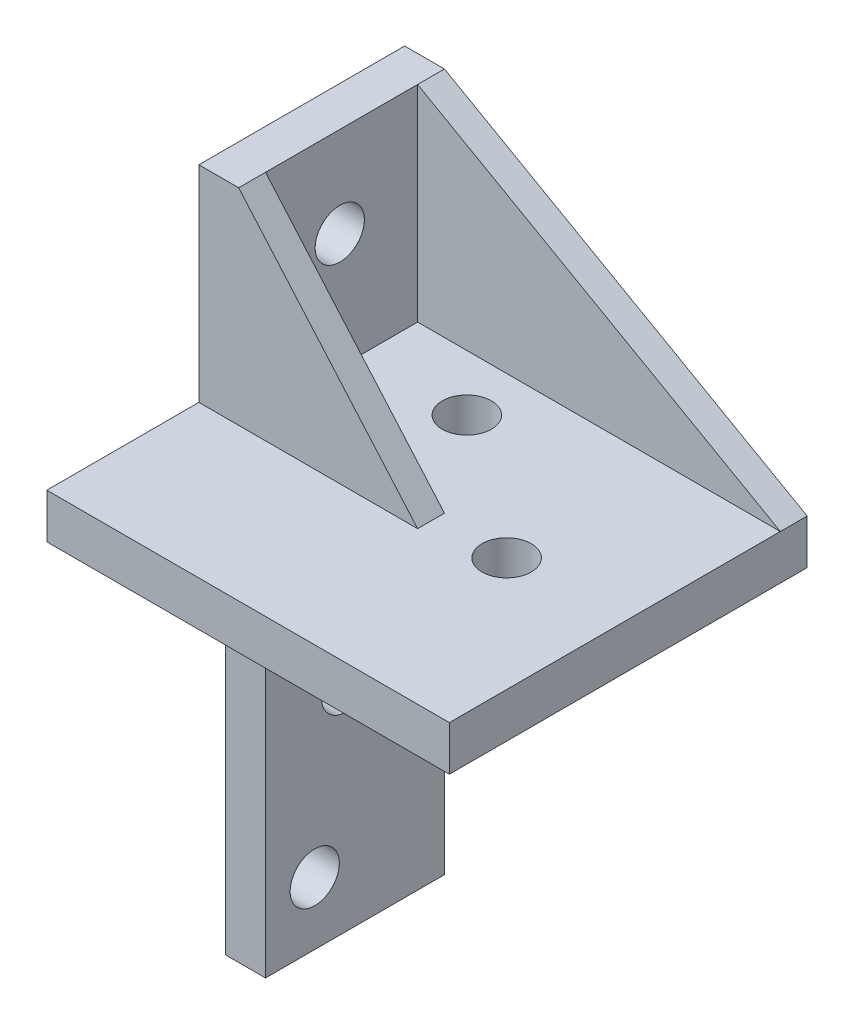
from build123d import *

# Parameters (mm, degrees)
SKETCH1_W           = 20
SKETCH1_H           = 50
BOSS_EXTRUDE1_DEPTH = 4.45
SKETCH2_W           = 45
SKETCH2_H           = 40
BOSS_EXTRUDE2_DEPTH = 5
CUT_EXTRUDE1_REACH  = 75.824
SKETCH4_R           = 2.75
SKETCH5_R           = 2.75
CUT_EXTRUDE2_DEPTH  = 72.199034404
SKETCH6_W           = 4.45
SKETCH6_H           = 20
BOSS_EXTRUDE3_DEPTH = 23
SKETCH7_R           = 2.75
CUT_EXTRUDE3_DEPTH  = 91.157098999
BOSS_EXTRUDE4_DEPTH = 3
BOSS_EXTRUDE5_DEPTH = 3


with BuildPart() as part:
    # Sketch1 → Boss-Extrude1 (new body)
    with BuildSketch(Plane(origin=(0, 0, 0), x_dir=(0, 0, -1), z_dir=(1, 0, 0))):
        with Locations((10, 25)):
            Rectangle(SKETCH1_W, SKETCH1_H)
    extrude(amount=BOSS_EXTRUDE1_DEPTH)

    # Sketch2 → Boss-Extrude2 (add)
    with BuildSketch(Plane(origin=(0, 50, 0), x_dir=(1, 0, 0), z_dir=(0, 1, 0))):
        with Locations((22.5, 0)):
            Rectangle(SKETCH2_W, SKETCH2_H)
    extrude(amount=BOSS_EXTRUDE2_DEPTH)

    # Sketch4 → Cut-Extrude1 (cut, up to next)
    with BuildSketch(Plane(origin=(0, 55, 0), x_dir=(1, 0, 0), z_dir=(0, 1, 0)), mode=Mode.PRIVATE) as cut_extrude1_sk1:
        with Locations(Location((32.25, -0.85, 0), (0, 0, 270))):
            Circle(SKETCH4_R)
    cut_extrude1_tool1 = extrude(cut_extrude1_sk1.sketch, amount=-CUT_EXTRUDE1_REACH, mode=Mode.PRIVATE) & part.part
    # Sketch4 → Cut-Extrude1 (cut, up to next)
    with BuildSketch(Plane(origin=(0, 55, 0), x_dir=(1, 0, 0), z_dir=(0, 1, 0)), mode=Mode.PRIVATE) as cut_extrude1_sk2:
        with Locations(Location((16.2, 10.75, 0), (0, 0, 270))):
            Circle(SKETCH4_R)
    cut_extrude1_tool2 = extrude(cut_extrude1_sk2.sketch, amount=-CUT_EXTRUDE1_REACH, mode=Mode.PRIVATE) & part.part
    add(cut_extrude1_tool1.solids().sort_by_distance((32.25, 55, 0.85))[0], mode=Mode.SUBTRACT)
    add(cut_extrude1_tool2.solids().sort_by_distance((16.2, 55, -10.75))[0], mode=Mode.SUBTRACT)

    # Sketch5 → Cut-Extrude2 (cut, through all)
    with BuildSketch(Plane(origin=(4.45, 0, 0), x_dir=(0, 0, -1), z_dir=(1, 0, 0))):
        with Locations((9, 24)):
            Circle(SKETCH5_R)
        with Locations((5.5, 7)):
            Circle(SKETCH5_R)
    extrude(amount=-CUT_EXTRUDE2_DEPTH, mode=Mode.SUBTRACT)

    # Sketch6 → Boss-Extrude3 (add)
    with BuildSketch(Plane(origin=(0, 55, 0), x_dir=(1, 0, 0), z_dir=(0, 1, 0))):
        with Locations((2.225, 10)):
            Rectangle(SKETCH6_W, SKETCH6_H)
    extrude(amount=BOSS_EXTRUDE3_DEPTH)

    # Sketch7 → Cut-Extrude3 (cut, through all)
    with BuildSketch(Plane(origin=(4.45, 0, 0), x_dir=(0, 0, -1), z_dir=(1, 0, 0))):
        with Locations((8.3, 67.9)):
            Circle(SKETCH7_R)
    extrude(amount=-CUT_EXTRUDE3_DEPTH, mode=Mode.SUBTRACT)

    # Sketch8 → Boss-Extrude4 (add)
    with BuildSketch(Plane(origin=(0, 0, -20), x_dir=(-1, 0, 0), z_dir=(0, 0, -1))):
        Polygon((-4.45, 78), (-4.45, 55), (-45, 55), align=None)
    extrude(amount=-BOSS_EXTRUDE4_DEPTH)

    # Sketch9 → Boss-Extrude5 (add)
    with BuildSketch(Plane.XY):
        Polygon((4.45, 55), (24.45, 55), (4.45, 78), (0, 78), (0, 55), align=None)
    extrude(amount=BOSS_EXTRUDE5_DEPTH)


solid = part.part
